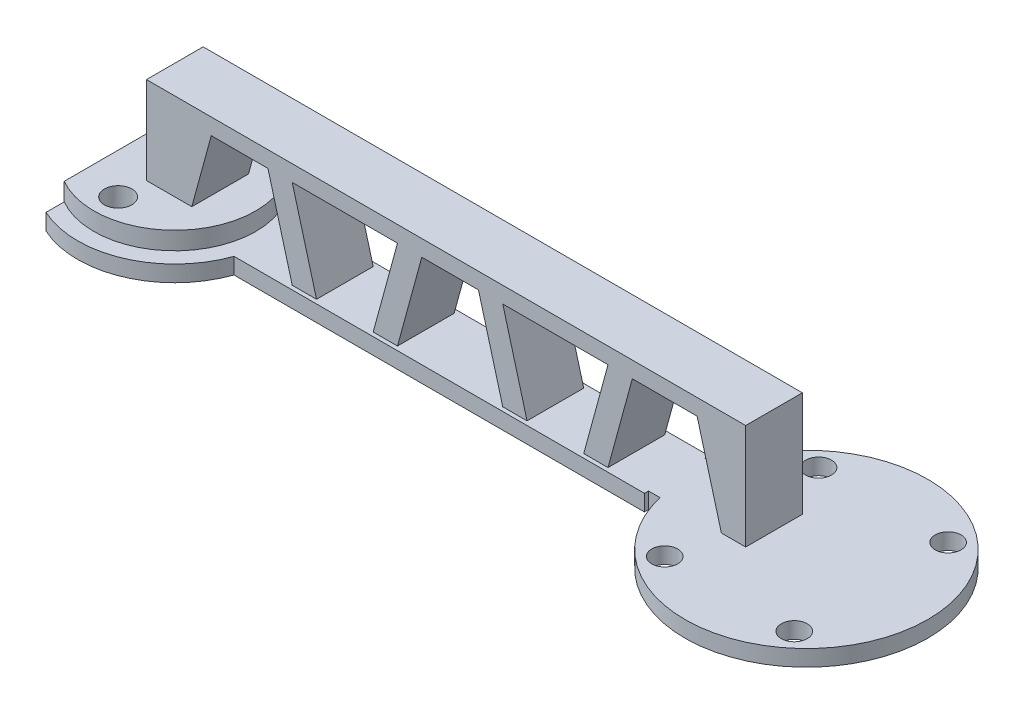
from build123d import *

# Parameters (mm, degrees)
SKETCH_1_W          = 62
SKETCH_1_H          = 8
EXTRUDE_1_DEPTH     = 2
SKETCH_2_R          = 12
SKETCH_2_R_2        = 1.7
EXTRUDE_2_DEPTH     = 2
EXTRUDE_START       = 2
SKETCH_3_R          = 10
SKETCH_3_R_2        = 1.7
EXTRUDE_3_DEPTH     = 2.2
EXTRUDE_START_2     = 13
SKETCH_4_W          = 20
SKETCH_4_H          = 7
EXTRUDE_4_DEPTH     = 2
SKETCH_5_R          = 15
SKETCH_5_R_2        = 1.6
EXTRUDE_5_DEPTH     = 2
EXTRUDE_START_3     = -3.5
SKETCH_6_W          = 74
SKETCH_6_H          = 15
EXTRUDE_6_DEPTH     = 7
SKETCH_7_W          = 13.866896788
SKETCH_7_H          = 9.192033752
CUT_EXTRUDE_1_DEPTH = 10
SKETCH_8_W          = 10
SKETCH_8_H          = 24
CUT_EXTRUDE_2_DEPTH = 10


with BuildPart() as part:
    # 草图1 → 凸台-拉伸1 (new body)
    with BuildSketch(Plane(origin=(0, 0, 0), x_dir=(1, 0, 0), z_dir=(0, 1, 0))):
        with Locations((31, 0)):
            Rectangle(SKETCH_1_W, SKETCH_1_H)
    extrude(amount=EXTRUDE_1_DEPTH)

    # 草图2 → 凸台-拉伸2 (add)
    with BuildSketch(Plane(origin=(0, 0, 0), x_dir=(1, 0, 0), z_dir=(0, 1, 0))):
        Circle(SKETCH_2_R)
        with Locations(Location((0, -7, 0), (0, 0, 270))):
            Circle(SKETCH_2_R_2, mode=Mode.SUBTRACT)
        with Locations(Location((0, 7, 0), (0, 0, 270))):
            Circle(SKETCH_2_R_2, mode=Mode.SUBTRACT)
    extrude(amount=EXTRUDE_2_DEPTH)

    # 草图3 → 凸台-拉伸3 (add)
    with BuildSketch(Plane(origin=(0, 0, 0), x_dir=(1, 0, 0), z_dir=(0, 1, 0)).offset(EXTRUDE_START)):
        with Locations(Location((0, 0, 0), (0, 0, 270))):
            Circle(SKETCH_3_R)
        with Locations(Location((0, -7, 0), (0, 0, 270))):
            Circle(SKETCH_3_R_2, mode=Mode.SUBTRACT)
        with Locations(Location((0, 7, 0), (0, 0, 270))):
            Circle(SKETCH_3_R_2, mode=Mode.SUBTRACT)
    extrude(amount=EXTRUDE_3_DEPTH)



with BuildPart() as body_2:
    # 草图4 → 凸台-拉伸4 (new body)
    with BuildSketch(Plane(origin=(0, 0, 0), x_dir=(1, 0, 0), z_dir=(0, 1, 0)).offset(EXTRUDE_START_2)):
        Rectangle(SKETCH_4_W, SKETCH_4_H)
    extrude(amount=EXTRUDE_4_DEPTH)


with BuildPart() as body_3:
    # 草图5 → 凸台-拉伸5 (new body)
    with BuildSketch(Plane(origin=(0, 0, 0), x_dir=(1, 0, 0), z_dir=(0, 1, 0))):
        with Locations(Location((78, 0, 0), (0, 0, 270))):
            Circle(SKETCH_5_R)
        with Locations(Location((70, -9.5, 0), (0, 0, 270))):
            Circle(SKETCH_5_R_2, mode=Mode.SUBTRACT)
        with Locations(Location((70, 9.5, 0), (0, 0, 270))):
            Circle(SKETCH_5_R_2, mode=Mode.SUBTRACT)
        with Locations(Location((86, -9.5, 0), (0, 0, 270))):
            Circle(SKETCH_5_R_2, mode=Mode.SUBTRACT)
        with Locations(Location((86, 9.5, 0), (0, 0, 270))):
            Circle(SKETCH_5_R_2, mode=Mode.SUBTRACT)
    extrude(amount=EXTRUDE_5_DEPTH)


with BuildPart() as part_1:
    add(part.part)

    add(body_2.part)  # 凸台-拉伸6 merges body 2

    add(body_3.part)  # 凸台-拉伸6 merges body 3
    # 草图6 → 凸台-拉伸6 (add)
    with BuildSketch(Plane.XY.offset(EXTRUDE_START_3)):
        with Locations((37, 7.5)):
            Rectangle(SKETCH_6_W, SKETCH_6_H)
        Polygon((5, 2), (18, 2), (15, 13), (8, 13), align=None, mode=Mode.SUBTRACT)
        Polygon((18, 13), (31, 13), (28, 2), (21, 2), align=None, mode=Mode.SUBTRACT)
        Polygon((31, 2), (44, 2), (41, 13), (34, 13), align=None, mode=Mode.SUBTRACT)
        Polygon((44, 13), (57, 13), (54, 2), (47, 2), align=None, mode=Mode.SUBTRACT)
        Polygon((57, 2), (71, 2), (68, 13), (60, 13), align=None, mode=Mode.SUBTRACT)
    extrude(amount=EXTRUDE_6_DEPTH)

    # 草图7 → 切除-拉伸1 (cut)
    with BuildSketch(Plane.XZ.offset(-13)):
        with Locations((-6.933448394, 0.107084937)):
            Rectangle(SKETCH_7_W, SKETCH_7_H)
    extrude(amount=-CUT_EXTRUDE_1_DEPTH, mode=Mode.SUBTRACT)

    # 草图8 → 切除-拉伸2 (cut)
    with BuildSketch(Plane(origin=(0, 4.2, 0), x_dir=(1, 0, 0), z_dir=(0, 1, 0))):
        with Locations((-10, 0)):
            Rectangle(SKETCH_8_W, SKETCH_8_H)
    extrude(amount=-CUT_EXTRUDE_2_DEPTH, mode=Mode.SUBTRACT)


solid = part_1.part
